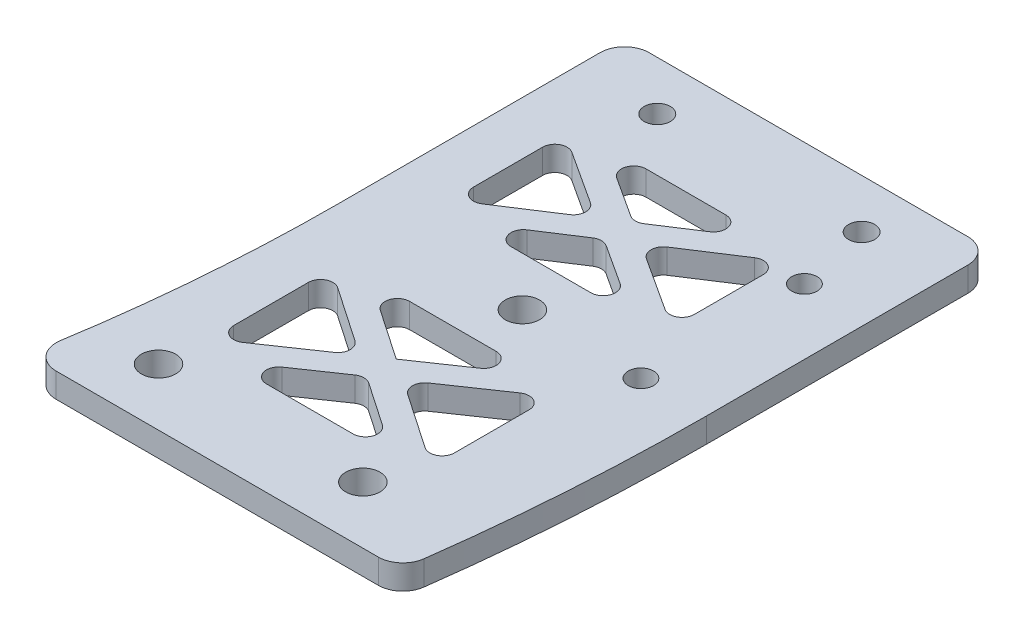
from build123d import *

# Parameters (mm, degrees)
SKETCH_1_R          = 2.1
EXTRUDE_1_DEPTH     = 3
SKETCH_2_R          = 2.1
SKETCH_2_R_2        = 1.6
CUT_EXTRUDE_1_DEPTH = 3
FILLET_1_R          = 3
SKETCH_5_R          = 1.55
CUT_EXTRUDE_3_DEPTH = 10
CUT_EXTRUDE_4_DEPTH = 3
FILLET_5_R          = 1.5


with BuildPart() as part:
    # 草图1 → 凸台-拉伸1 (new body)
    with BuildSketch(Plane(origin=(0, 0, 0), x_dir=(1, 0, 0), z_dir=(0, 1, 0))):
        with BuildLine():
            Line((-22.5, 0), (-22.5, 35))
            Line((-22.5, 35), (22.5, 35))
            Line((22.5, 35), (22.5, 0))
            ThreePointArc((22.5, 0), (21.870970759, -17.545046315), (19.98711306, -35))
            Line((19.98711306, -35), (-25.586313325, -35))
            ThreePointArc((-25.586313325, -35), (-23.273072434, -17.56790632), (-22.5, 0))
        make_face()
        with Locations(Location((0, 0, 0), (0, 0, 270))):
            Circle(SKETCH_1_R, mode=Mode.SUBTRACT)
    extrude(amount=EXTRUDE_1_DEPTH)

    # 草图2 → 切除-拉伸1 (cut)
    with BuildSketch(Plane(origin=(0, 3, 0), x_dir=(1, 0, 0), z_dir=(0, 1, 0))):
        with Locations(Location((-16.51288694, -28, 0), (0, 0, 270))):
            Circle(SKETCH_2_R)
        with Locations(Location((8.48711306, -28, 0), (0, 0, 270))):
            Circle(SKETCH_2_R)
        with Locations(Location((-12.5, 29, 0), (0, 0, 270))):
            Circle(SKETCH_2_R_2)
        with Locations(Location((12.5, 29, 0), (0, 0, 270))):
            Circle(SKETCH_2_R_2)
    extrude(amount=-CUT_EXTRUDE_1_DEPTH, mode=Mode.SUBTRACT)

    # 圆角1
    fillet_1_edges = [part.edges().sort_by_distance(p)[0] for p in [
        (-22.5, 1.5, -35),
        (22.5, 1.5, -35),
        (19.98711306, 1.5, 35),
        (-25.586313325, 1.5, 35),
    ]]
    fillet(fillet_1_edges, radius=FILLET_1_R)

    # 草图5 → 切除-拉伸3 (cut)
    with BuildSketch(Plane.XZ):
        with Locations(Location((14.5, 0, 0), (0, 0, 270))):
            Circle(SKETCH_5_R)
        with Locations(Location((14.5, -20, 0), (0, 0, 270))):
            Circle(SKETCH_5_R)
    extrude(amount=-CUT_EXTRUDE_3_DEPTH, mode=Mode.SUBTRACT)

    # 草图6 → 切除-拉伸4 (cut)
    with BuildSketch(Plane(origin=(0, 3, 0), x_dir=(1, 0, 0), z_dir=(0, 1, 0))):
        Polygon((7.439955283, 22.5), (-12.439955283, 22.5), (-2.5, 16.039029066), align=None)
        Polygon((-5.25235241, 14.25), (-16, 21.235970934), (-16, 7.264029066), align=None)
        Polygon((7.439955283, 6), (-2.5, 12.460970934), (-12.439955283, 6), align=None)
        Polygon((11, 21.235970934), (0.25235241, 14.25), (11, 7.264029066), align=None)
        Polygon((7.646201615, -6), (-12.646201615, -6), (-2.5, -12.93323777), align=None)
        Polygon((-5.158676434, -14.75), (-16, -7.34176223), (-16, -22.15823777), align=None)
        Polygon((7.646201615, -23.5), (-2.5, -16.56676223), (-12.646201615, -23.5), align=None)
        Polygon((11, -7.34176223), (0.158676434, -14.75), (11, -22.15823777), align=None)
    extrude(amount=-CUT_EXTRUDE_4_DEPTH, mode=Mode.SUBTRACT)

    # 圆角5
    fillet_5_edges = [part.edges().sort_by_distance(p)[0] for p in [
        (-12.646201615, 1.5, 6),
        (7.646201615, 1.5, 6),
        (11, 1.5, -21.235970934),
        (11, 1.5, -7.264029066),
        (0.25235241, 1.5, -14.25),
        (-5.25235241, 1.5, -14.25),
        (-16, 1.5, -7.264029066),
        (-16, 1.5, -21.235970934),
        (-2.5, 1.5, -12.460970934),
        (7.439955283, 1.5, -6),
        (-12.439955283, 1.5, -6),
        (11, 1.5, 7.34176223),
        (11, 1.5, 22.15823777),
        (0.158676434, 1.5, 14.75),
        (-16, 1.5, 7.34176223),
        (-5.158676434, 1.5, 14.75),
        (-16, 1.5, 22.15823777),
        (-2.5, 1.5, 16.56676223),
        (7.646201615, 1.5, 23.5),
        (-12.646201615, 1.5, 23.5),
        (-12.439955283, 1.5, -22.5),
        (7.439955283, 1.5, -22.5),
        (-2.5, 1.5, -16.039029066),
    ]]
    fillet(fillet_5_edges, radius=FILLET_5_R)


solid = part.part
